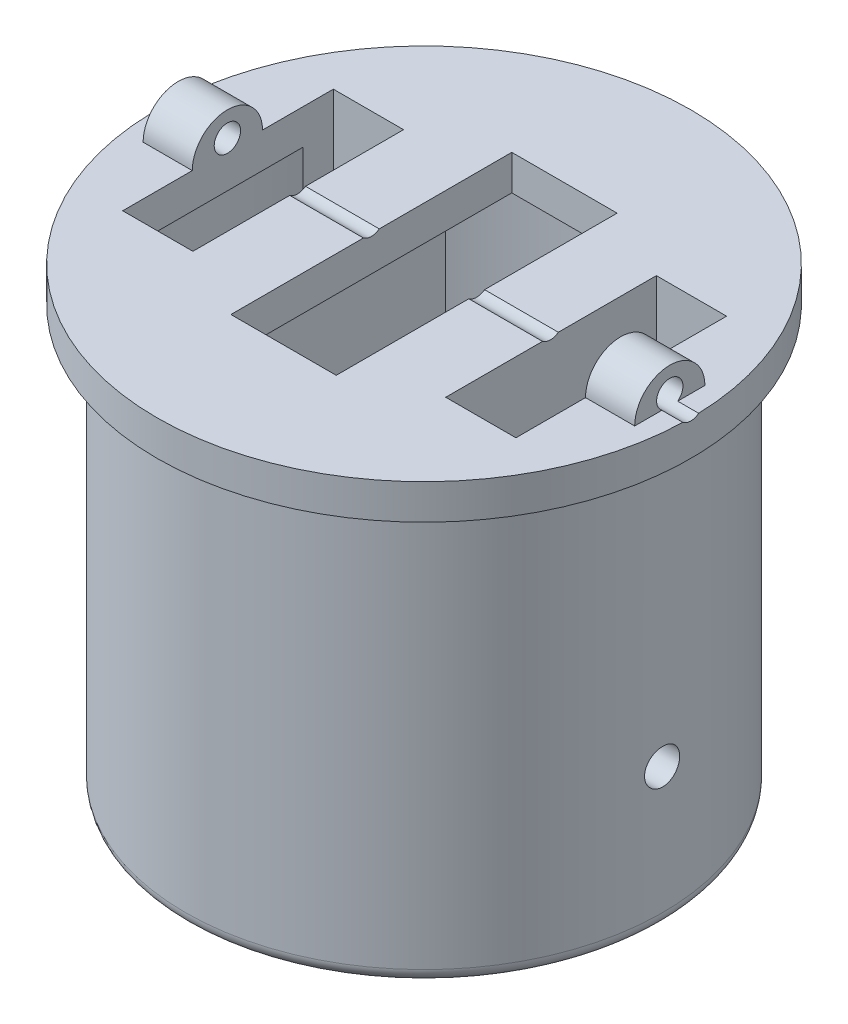
from build123d import *

# Parameters (mm, degrees)
SKETCH1_R               = 43.18
SKETCH1_R_2             = 38.1
BOSS_EXTRUDE1_DEPTH     = 76.2
SKETCH4_R               = 48.26
BOSS_EXTRUDE2_DEPTH     = 6.35
SKETCH5_W               = 19.05
SKETCH5_H               = 50.8
CUT_EXTRUDE2_DEPTH      = 6.35
BOSS_EXTRUDE3_DEPTH     = 8.89
CUT_EXTRUDE3_START      = -12.7
SKETCH7_R               = 2.38125
CUT_EXTRUDE3_DEPTH      = 99.06
CUT_EXTRUDE4_DEPTH      = 48.26
CUT_EXTRUDE4_DEPTH_BACK = 48.26
SKETCH8_R               = 3.175
FILLET2_R               = 2.54
SKETCH11_W              = 12.7
SKETCH11_H              = 38.1
CUT_EXTRUDE5_DEPTH      = 69.85
BOSS_EXTRUDE4_DEPTH     = 44.45


with BuildPart() as part:
    # Sketch1 → Boss-Extrude1 (new body)
    with BuildSketch(Plane(origin=(0, 0, 0), x_dir=(1, 0, 0), z_dir=(0, 1, 0))):
        with Locations(Location((0, 0, 0), (0, 0, 90))):
            Circle(SKETCH1_R)
        with Locations(Location((0, 0, 0), (0, 0, 90))):
            Circle(SKETCH1_R_2, mode=Mode.SUBTRACT)
    extrude(amount=BOSS_EXTRUDE1_DEPTH)

    # Sketch4 → Boss-Extrude2 (add)
    with BuildSketch(Plane(origin=(0, 76.2, 0), x_dir=(1, 0, 0), z_dir=(0, 1, 0))):
        with Locations(Location((0, 0, 0), (0, 0, 270))):
            Circle(SKETCH4_R)
    extrude(amount=BOSS_EXTRUDE2_DEPTH)

    # Sketch5 → Cut-Extrude2 (cut)
    with BuildSketch(Plane(origin=(0, 82.55, 0), x_dir=(1, 0, 0), z_dir=(0, 1, 0))):
        Rectangle(SKETCH5_W, SKETCH5_H)
    extrude(amount=-CUT_EXTRUDE2_DEPTH, mode=Mode.SUBTRACT)

    # Sketch6 → Boss-Extrude3 (add)
    with BuildSketch(Plane(origin=(35.56, 0, 0), x_dir=(0, 0, -1), z_dir=(1, 0, 0))):
        with BuildLine():
            Line((-6.35, 82.55), (6.35, 82.55))
            ThreePointArc((6.35, 82.55), (0, 88.9), (-6.35, 82.55))
        make_face()
    boss_extrude3 = extrude(amount=BOSS_EXTRUDE3_DEPTH)

    # Sketch7 → Cut-Extrude3 (cut)
    with BuildSketch(Plane.ZY.offset(-35.56).offset(CUT_EXTRUDE3_START)):
        with Locations(Location((0, 84.455, 0), (0, 0, 233.130102354))):
            Circle(SKETCH7_R)
    cut_extrude3 = extrude(amount=CUT_EXTRUDE3_DEPTH, mode=Mode.SUBTRACT)

    # Mirror1: Boss-Extrude3, Cut-Extrude3 across plane
    add(boss_extrude3.mirror(Plane(origin=(0, 0, 0), x_dir=(0, 0, 1), z_dir=(1, 0, 0))))
    add(cut_extrude3.mirror(Plane(origin=(0, 0, 0), x_dir=(0, 0, 1), z_dir=(1, 0, 0))), mode=Mode.SUBTRACT)

    # Sketch8 → Cut-Extrude4 (cut, two sides: drawn at the far end of the back side and taken through both)
    with BuildSketch(Plane(origin=(0, 0, 0), x_dir=(0, 0, -1), z_dir=(1, 0, 0)).offset(-CUT_EXTRUDE4_DEPTH_BACK)):
        with Locations(Location((0, 25.4, 0), (0, 0, 180))):
            Circle(SKETCH8_R)
    extrude(amount=CUT_EXTRUDE4_DEPTH + CUT_EXTRUDE4_DEPTH_BACK, mode=Mode.SUBTRACT)

    # Fillet2
    fillet2_edges = [part.edges().sort_by_distance(p)[0] for p in [
        (0, 0, 43.18),
    ]]
    fillet(fillet2_edges, radius=FILLET2_R)

    # Sketch11 → Cut-Extrude5 (cut)
    with BuildSketch(Plane(origin=(0, 82.55, 0), x_dir=(1, 0, 0), z_dir=(0, 1, 0))):
        with Locations((29.21, 0.11160914)):
            Rectangle(SKETCH11_W, SKETCH11_H)
        with Locations((-29.21, 0.11160914)):
            Rectangle(SKETCH11_W, SKETCH11_H)
    extrude(amount=-CUT_EXTRUDE5_DEPTH, mode=Mode.SUBTRACT)

    # Sketch12 → Boss-Extrude4 (add)
    with BuildSketch(Plane.XZ.offset(-76.2)):
        Polygon((-19.05, 22.74839086), (-31.75, 22.74839086), (-33.059754259, 18.93839086), (-22.86, 18.93839086), (-22.86, -19.16160914), (-32.930878141, -19.16160914), (-31.75, -22.97160914), (-19.05, -22.97160914), align=None)
        Polygon((22.86, 18.93839086), (22.86, -19.16160914), (32.930878141, -19.16160914), (31.75, -22.97160914), (19.05, -22.97160914), (19.05, 22.74839086), (31.75, 22.74839086), (33.059754259, 18.93839086), align=None)
    extrude(amount=BOSS_EXTRUDE4_DEPTH)


solid = part.part
